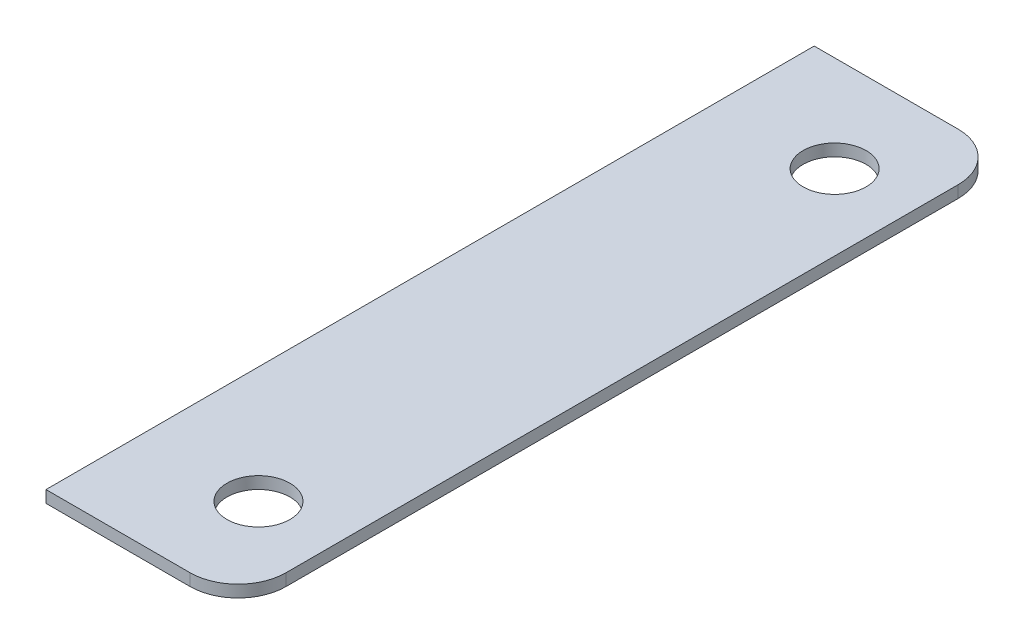
from build123d import *

# Parameters (mm, degrees)
SKETCH1_W           = 25.4
SKETCH1_H           = 101.6
BOSS_EXTRUDE1_DEPTH = 1.5875
FILLET2_R           = 6.35
CUT_EXTRUDE1_REACH  = 54.388
SKETCH2_R           = 4.165


with BuildPart() as part:
    # Sketch1 → Boss-Extrude1 (new body)
    with BuildSketch(Plane(origin=(0, 0, 0), x_dir=(1, 0, 0), z_dir=(0, 1, 0))):
        Rectangle(SKETCH1_W, SKETCH1_H)
    extrude(amount=BOSS_EXTRUDE1_DEPTH)

    # Fillet2
    fillet2_edges = [part.edges().sort_by_distance(p)[0] for p in [
        (12.7, 0.79375, 50.8),
        (12.7, 0.79375, -50.8),
    ]]
    fillet(fillet2_edges, radius=FILLET2_R)

    # Sketch2 → Cut-Extrude1 (cut, up to next)
    with BuildSketch(Plane(origin=(0, 1.5875, 0), x_dir=(1, 0, 0), z_dir=(0, 1, 0)), mode=Mode.PRIVATE) as cut_extrude1_sk1:
        with Locations(Location((2.7, 38.1, 0), (0, 0, 270))):
            Circle(SKETCH2_R)
    cut_extrude1_tool1 = extrude(cut_extrude1_sk1.sketch, amount=-CUT_EXTRUDE1_REACH, mode=Mode.PRIVATE) & part.part
    # Sketch2 → Cut-Extrude1 (cut, up to next)
    with BuildSketch(Plane(origin=(0, 1.5875, 0), x_dir=(1, 0, 0), z_dir=(0, 1, 0)), mode=Mode.PRIVATE) as cut_extrude1_sk2:
        with Locations(Location((2.7, -38.1, 0), (0, 0, 270))):
            Circle(SKETCH2_R)
    cut_extrude1_tool2 = extrude(cut_extrude1_sk2.sketch, amount=-CUT_EXTRUDE1_REACH, mode=Mode.PRIVATE) & part.part
    add(cut_extrude1_tool1.solids().sort_by_distance((2.7, 1.5875, -38.1))[0], mode=Mode.SUBTRACT)
    add(cut_extrude1_tool2.solids().sort_by_distance((2.7, 1.5875, 38.1))[0], mode=Mode.SUBTRACT)


solid = part.part
